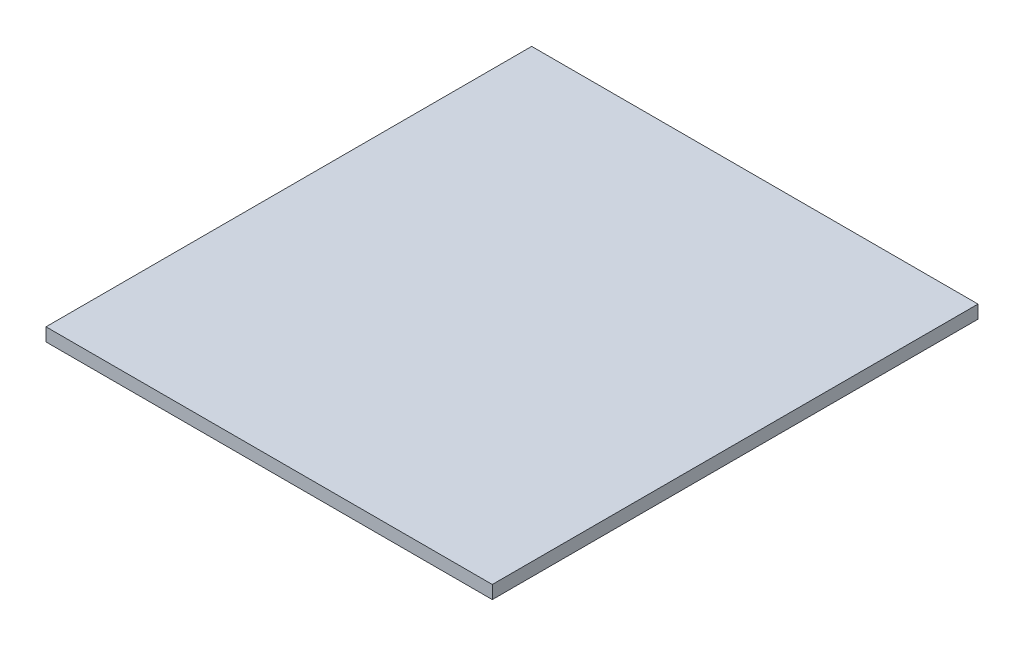
from build123d import *

# Parameters (mm, degrees)
SKETCH1_W           = 150
SKETCH1_H           = 150
BOSS_EXTRUDE1_DEPTH = 3
CUT_EXTRUDE1_DEPTH  = 10


with BuildPart() as part:
    # Sketch1 → Boss-Extrude1 (new body)
    with BuildSketch(Plane(origin=(0, 0, 0), x_dir=(1, 0, 0), z_dir=(0, 1, 0))):
        Rectangle(SKETCH1_W, SKETCH1_H)
    extrude(amount=BOSS_EXTRUDE1_DEPTH)

    # Sketch2 → Cut-Extrude1 (cut)
    with BuildSketch(Plane(origin=(0, 3, 0), x_dir=(1, 0, 0), z_dir=(0, 1, 0))):
        Polygon((-50, -75), (-50, 36), (52, 36), (52, -75), (75, -75), (75, 75), (-75, 75), (-75, -75), align=None)
    extrude(amount=-CUT_EXTRUDE1_DEPTH, mode=Mode.SUBTRACT)


solid = part.part
